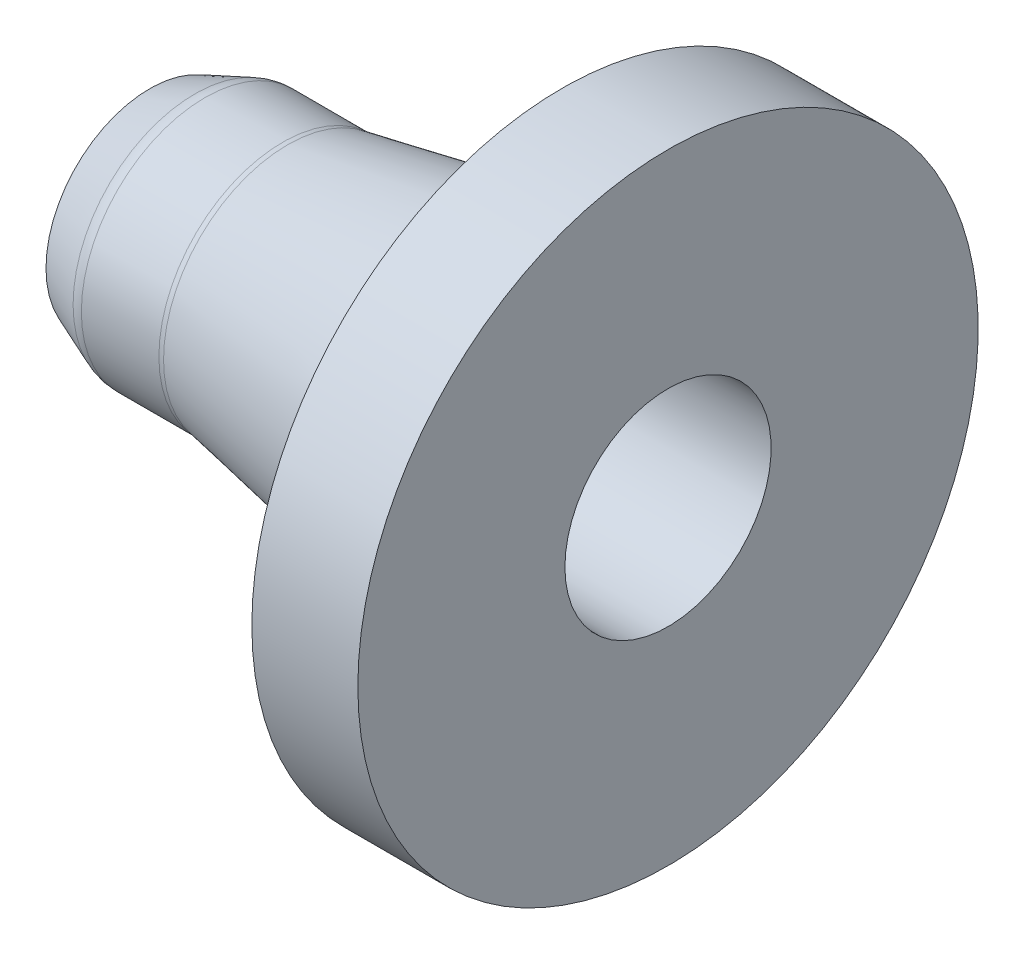
from build123d import *

# Parameters (mm, degrees)
FILLET1_R = 0.2


with BuildPart() as part:
    # Sketch1 → Revolve1 (revolve)
    with BuildSketch(Plane.XY, mode=Mode.PRIVATE) as revolve1_sk:
        Polygon((0.023957278, 0.75), (0.023957278, 0.754156772), (0.388348543, 0.9), (1.009684916, 0.9), (2.273270828, 1.140273658), (2.273270828, 0.96522222), (3.022946529, 0.96522222), (3.022946529, 2.256034163), (3.793957278, 2.256034163), (3.793957278, 0.9), (3.793957278, 0.75), align=None)
    revolve(revolve1_sk.sketch.rotate(Axis((0, 0, 0), (1, 0, 0)), 90), axis=Axis((0, 0, 0), (1, 0, 0)))

    # Fillet1
    fillet1_edges = [part.edges().sort_by_distance(p)[0] for p in [
        (1.009684916, 0, -0.9),
        (0.388348543, 0, -0.9),
    ]]
    fillet(fillet1_edges, radius=FILLET1_R)


solid = part.part
